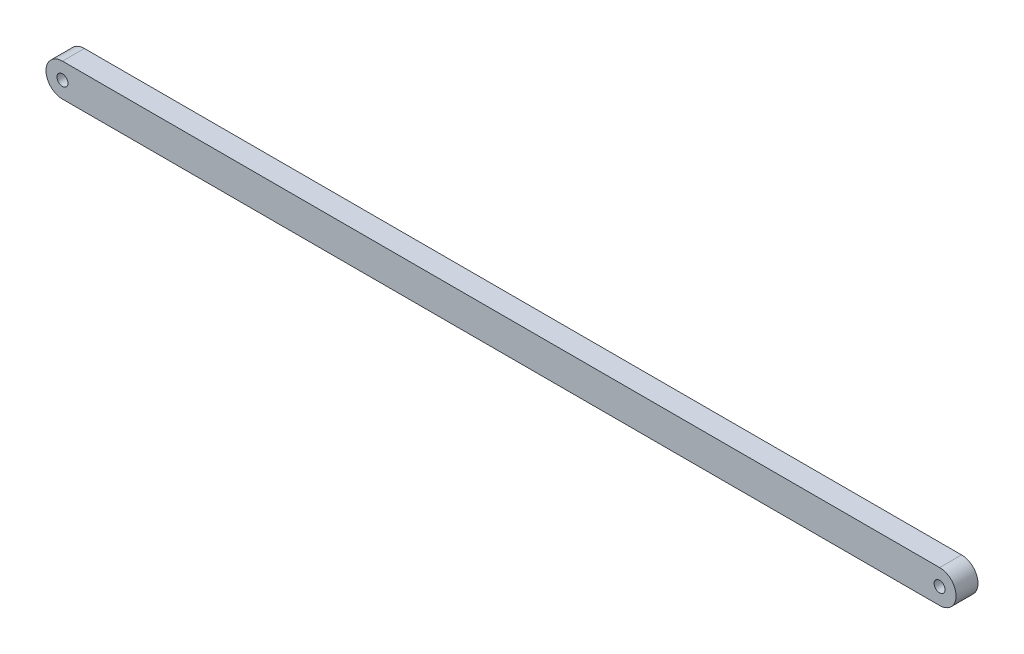
from build123d import *

# Parameters (mm, degrees)
SKETCH_1_R      = 0.5
EXTRUDE_1_DEPTH = 2


with BuildPart() as part:
    # 草图1 → 凸台-拉伸1 (new body)
    with BuildSketch(Plane.XY):
        with BuildLine():
            Line((-50.540209051, 31.078269692), (29.459790949, 31.078269692))
            ThreePointArc((29.459790949, 31.078269692), (30.959790949, 29.578269692), (29.459790949, 28.078269692))
            Line((29.459790949, 28.078269692), (-50.540209051, 28.078269692))
            ThreePointArc((-50.540209051, 28.078269692), (-52.040209051, 29.578269692), (-50.540209051, 31.078269692))
        make_face()
        with Locations((-50.540209051, 29.578269692)):
            Circle(SKETCH_1_R, mode=Mode.SUBTRACT)
        with Locations((29.459790949, 29.578269692)):
            Circle(SKETCH_1_R, mode=Mode.SUBTRACT)
    extrude(amount=EXTRUDE_1_DEPTH)


solid = part.part
